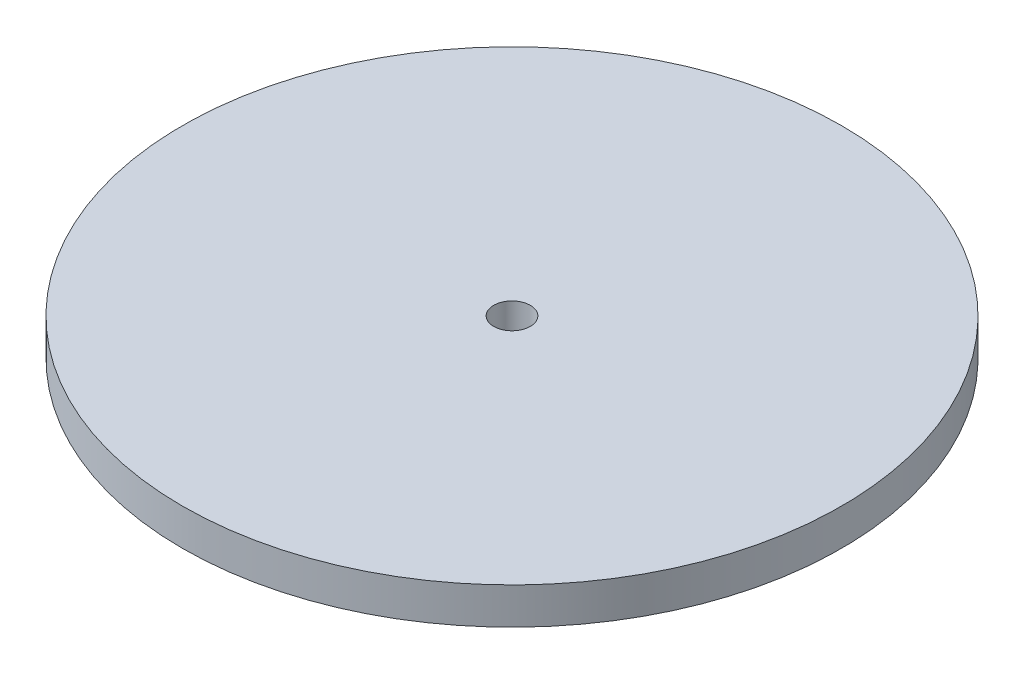
from build123d import *

# Parameters (mm, degrees)
SKETCH_1_R          = 90
EXTRUDE_1_DEPTH     = 10
SKETCH_2_R          = 5
CUT_EXTRUDE_1_DEPTH = 10


with BuildPart() as part:
    # 草图1 → 凸台-拉伸1 (new body)
    with BuildSketch(Plane(origin=(0, 0, 0), x_dir=(1, 0, 0), z_dir=(0, 1, 0))):
        with Locations(Location((0, 0, 0), (0, 0, 270))):
            Circle(SKETCH_1_R)
    extrude(amount=EXTRUDE_1_DEPTH)

    # 草图2 → 切除-拉伸1 (cut)
    with BuildSketch(Plane(origin=(0, 10, 0), x_dir=(1, 0, 0), z_dir=(0, 1, 0))):
        with Locations(Location((0, 0, 0), (0, 0, 270))):
            Circle(SKETCH_2_R)
    extrude(amount=-CUT_EXTRUDE_1_DEPTH, mode=Mode.SUBTRACT)


solid = part.part
